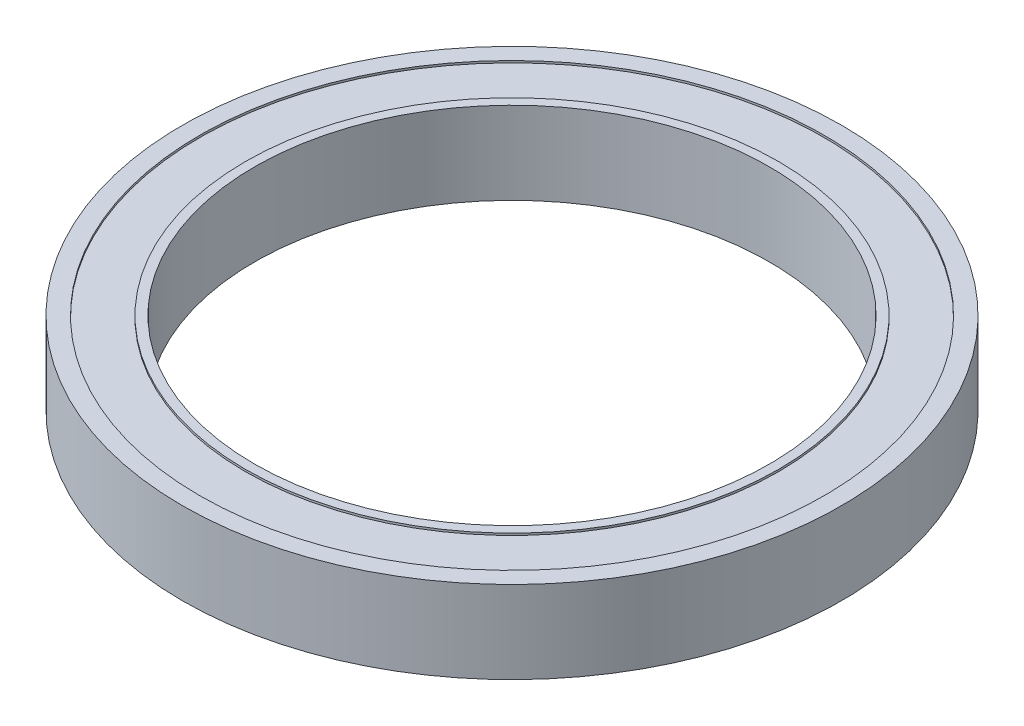
from build123d import *

# Parameters (mm, degrees)
SKETCH_1_R          = 16
SKETCH_1_R_2        = 12.5
EXTRUDE_1_DEPTH     = 2
SKETCH_2_R          = 15.15884167
SKETCH_2_R_2        = 12.943213886
CUT_EXTRUDE_1_DEPTH = 0.1


with BuildPart() as part:
    # 草图1 → 凸台-拉伸1 (new, symmetric)
    with BuildSketch(Plane(origin=(0, 0, 0), x_dir=(1, 0, 0), z_dir=(0, 1, 0))):
        with Locations(Location((0, 0, 0), (0, 0, 270))):
            Circle(SKETCH_1_R)
        with Locations(Location((0, 0, 0), (0, 0, 270))):
            Circle(SKETCH_1_R_2, mode=Mode.SUBTRACT)
    extrude(amount=EXTRUDE_1_DEPTH, both=True)

    # 草图2 → 切除-拉伸1 (cut)
    with BuildSketch(Plane(origin=(0, 2, 0), x_dir=(1, 0, 0), z_dir=(0, 1, 0))):
        with Locations(Location((0, 0, 0), (0, 0, 270))):
            Circle(SKETCH_2_R)
        with Locations(Location((0, 0, 0), (0, 0, 270))):
            Circle(SKETCH_2_R_2, mode=Mode.SUBTRACT)
    cut_extrude_1 = extrude(amount=-CUT_EXTRUDE_1_DEPTH, mode=Mode.SUBTRACT)

    # 镜向1: 切除-拉伸1 across plane
    add(cut_extrude_1.mirror(Plane.ZX), mode=Mode.SUBTRACT)


solid = part.part
